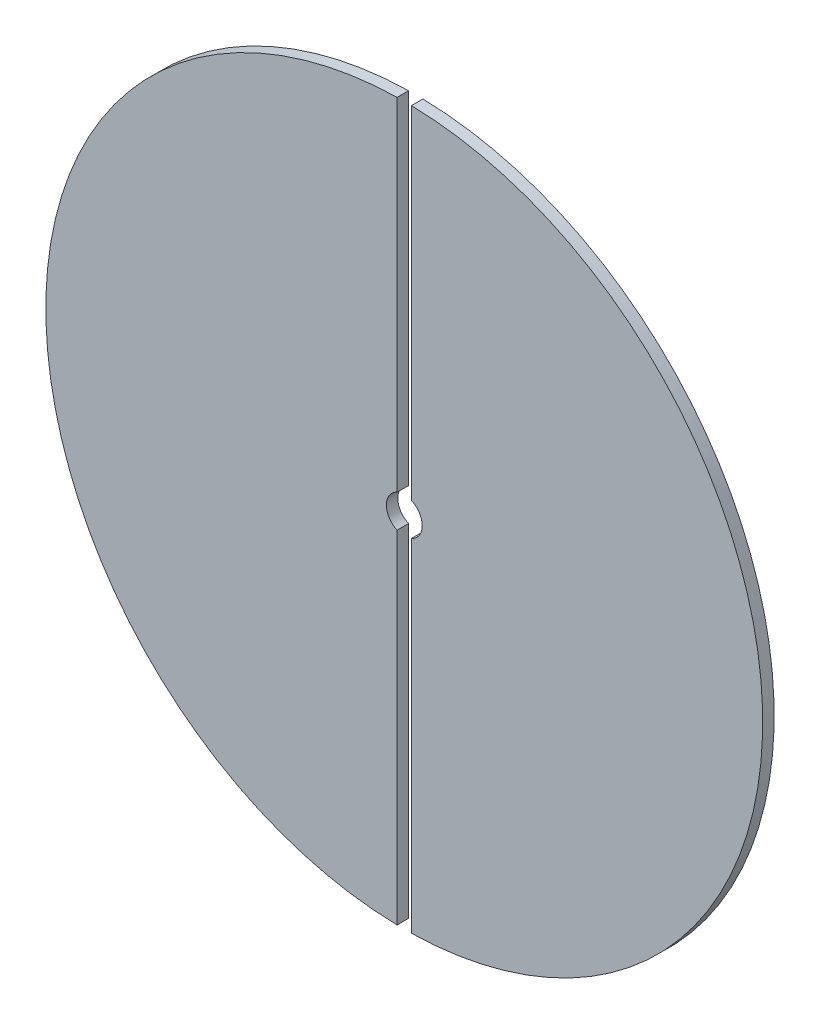
from build123d import *

# Parameters (mm, degrees)
AUFSATZ_LINEAR_AUSTRAGEN1_DEPTH   = 1.6
AUFSATZ_LINEAR_AUSTRAGEN1_2_DEPTH = 1.6


with BuildPart() as part:
    # Skizze1 → Aufsatz-Linear austragen1 (new body)
    with BuildSketch(Plane.XY):
        with BuildLine():
            Line((-1, 49.989999), (-1, 2.291287847))
            ThreePointArc((-1, 2.291287847), (-2.5, 0), (-1, -2.291287847))
            Line((-1, -2.291287847), (-1, -49.989999))
            ThreePointArc((-1, -49.989999), (-50, 0), (-1, 49.989999))
        make_face()
    extrude(amount=AUFSATZ_LINEAR_AUSTRAGEN1_DEPTH)


with BuildPart() as body_2:
    # Skizze1 → Aufsatz-Linear austragen1 2 (new body)
    with BuildSketch(Plane.XY):
        with BuildLine():
            Line((1, 49.989999), (1, 2.291287847))
            ThreePointArc((1, 2.291287847), (2.5, 0), (1, -2.291287847))
            Line((1, -2.291287847), (1, -49.989999))
            ThreePointArc((1, -49.989999), (50, 0), (1, 49.989999))
        make_face()
    extrude(amount=AUFSATZ_LINEAR_AUSTRAGEN1_2_DEPTH)


solid = Compound([part.part, body_2.part])
